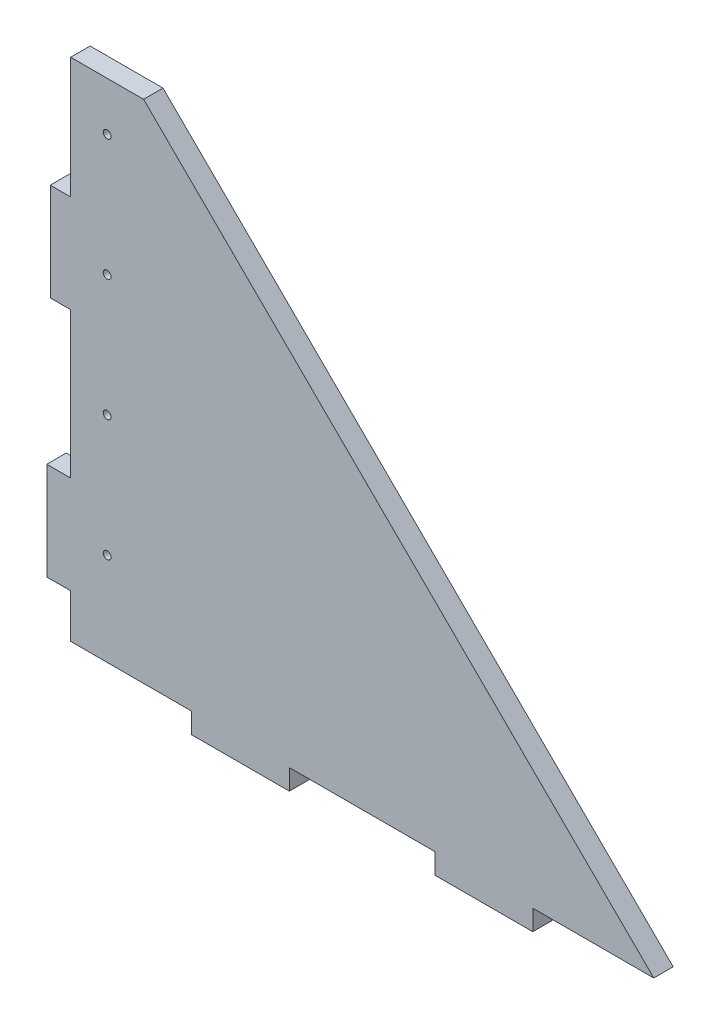
from build123d import *

# Parameters (mm, degrees)
BOSS_EXTRUDE1_DEPTH = 4
SKETCH2_R           = 0.8
CUT_EXTRUDE1_DEPTH  = 4
LPATTERN1_COUNT     = 4
LPATTERN1_PITCH     = 25


with BuildPart() as part:
    # Sketch1 → Boss-Extrude1 (new body)
    with BuildSketch(Plane.XY):
        Polygon((0, 0), (0, 9.01), (-4.913167973, 9.01), (-4.913167973, 29.11), (0, 29.11), (0, 59.11), (-4.2, 59.11), (-4.2, 79.21), (0, 79.21), (0, 104.11), (15, 104.11), (120, 0), (95.1, 0), (95.1, -4.2), (75, -4.2), (75, 0), (45, 0), (45, -4.2), (24.9, -4.2), (24.9, 0), align=None)
    extrude(amount=BOSS_EXTRUDE1_DEPTH)

    # Sketch2 → Cut-Extrude1 (cut)
    with BuildSketch(Plane.XY.offset(4)):
        with Locations((7.5, 94.11)):
            Circle(SKETCH2_R)
    cut_extrude1 = extrude(amount=-CUT_EXTRUDE1_DEPTH, mode=Mode.SUBTRACT)

    # LPattern1: Cut-Extrude1 ×4
    with Locations(*[(0, -i * LPATTERN1_PITCH, 0) for i in range(1, LPATTERN1_COUNT)]):
        add(cut_extrude1, mode=Mode.SUBTRACT)


solid = part.part
